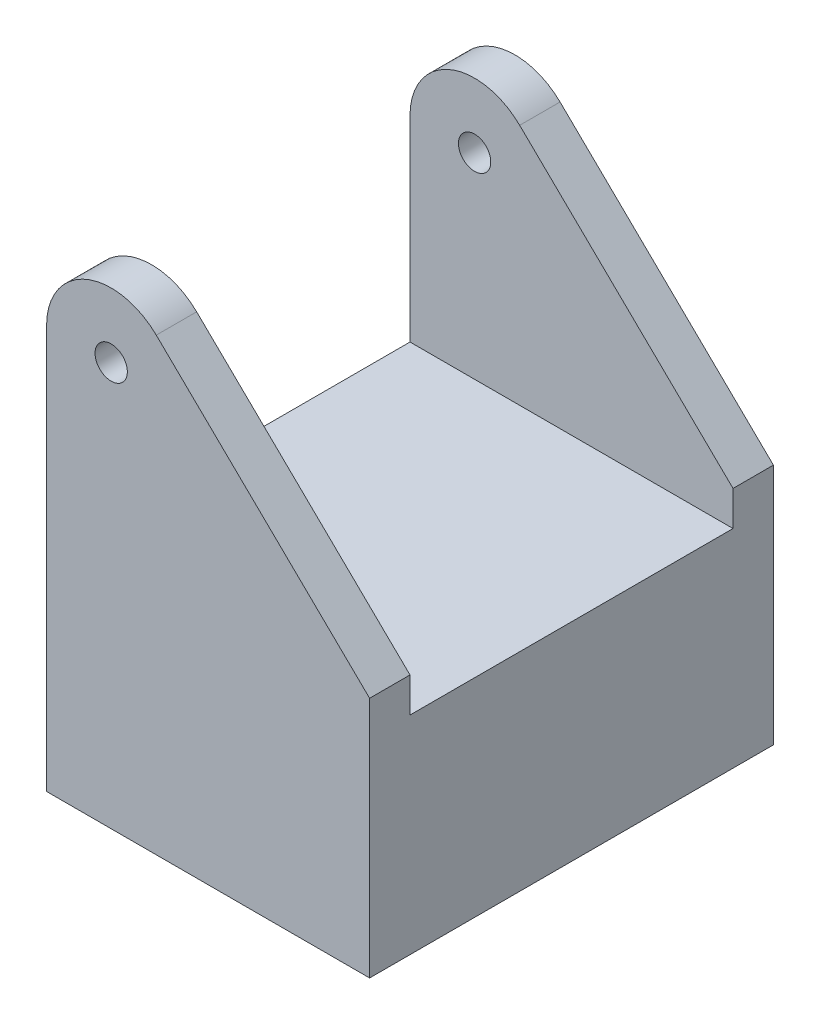
from build123d import *

# Parameters (mm, degrees)
CROQUIS1_R              = 10
SALIENTE_EXTRUIR1_DEPTH = 250
CROQUIS3_W              = 200
CROQUIS3_H              = 161.5
CORTAR_EXTRUIR1_DEPTH   = 250


with BuildPart() as part:
    # Croquis1 → Saliente-Extruir1 (new body)
    with BuildSketch(Plane.XY):
        with BuildLine():
            Line((0, 150), (0, 250))
            ThreePointArc((0, 250), (24.449494329, 286.853517788), (67.909088668, 278.654541869))
            Line((67.909088668, 278.654541869), (200, 150))
            Line((200, 150), (200, 0))
            Line((200, 0), (0, 0))
            Line((0, 0), (0, 150))
        make_face()
        with Locations((40, 250)):
            Circle(CROQUIS1_R, mode=Mode.SUBTRACT)
    extrude(amount=SALIENTE_EXTRUIR1_DEPTH)

    # Croquis3 → Cortar-Extruir1 (cut)
    with BuildSketch(Plane.ZY):
        with Locations((125, 209.25)):
            Rectangle(CROQUIS3_W, CROQUIS3_H)
    extrude(amount=-CORTAR_EXTRUIR1_DEPTH, mode=Mode.SUBTRACT)


solid = part.part
